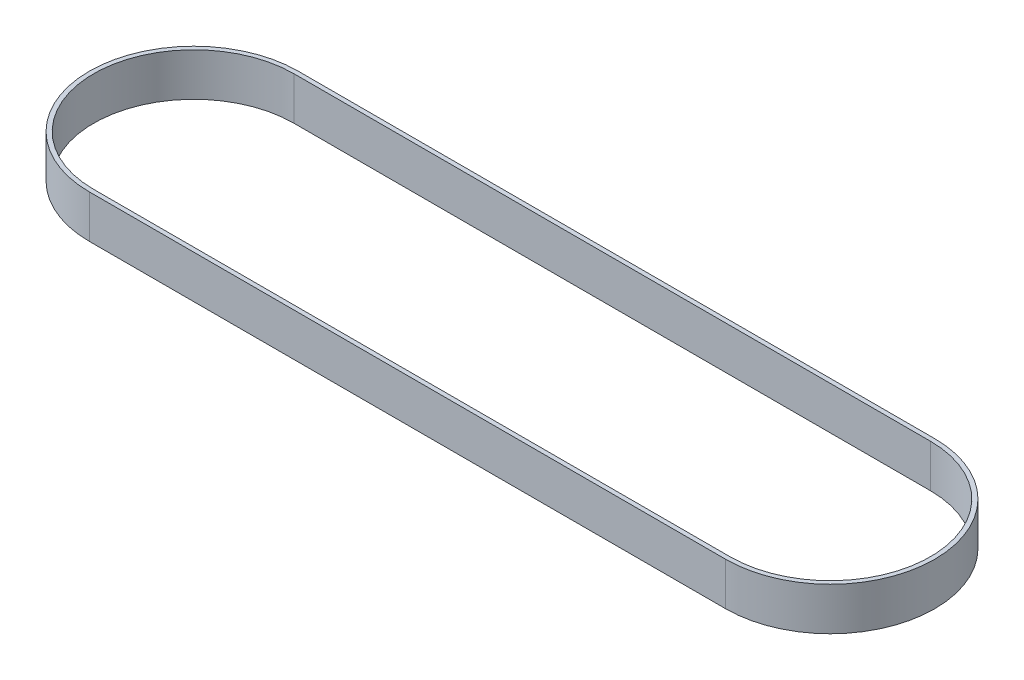
from build123d import *

# Parameters (mm, degrees)
BOSS_EXTRUDE1_DEPTH = 15


with BuildPart() as part:
    # Sketch1 → Boss-Extrude1 (new body)
    with BuildSketch(Plane(origin=(0, 0, 0), x_dir=(1, 0, 0), z_dir=(0, 1, 0))):
        with BuildLine():
            Line((0, -36.5379), (222.5548, -36.5379))
            ThreePointArc((222.5548, -36.5379), (259.0927, 0), (222.5548, 36.5379))
            Line((222.5548, 36.5379), (0, 36.5379))
            ThreePointArc((0, 36.5379), (-36.5379, 0), (0, -36.5379))
        make_face()
        with BuildLine():
            Line((0, 35.0139), (222.5548, 35.0139))
            ThreePointArc((222.5548, 35.0139), (257.5687, 0), (222.5548, -35.0139))
            Line((222.5548, -35.0139), (0, -35.0139))
            ThreePointArc((0, -35.0139), (-35.0139, 0), (0, 35.0139))
        make_face(mode=Mode.SUBTRACT)
    extrude(amount=BOSS_EXTRUDE1_DEPTH)


solid = part.part
